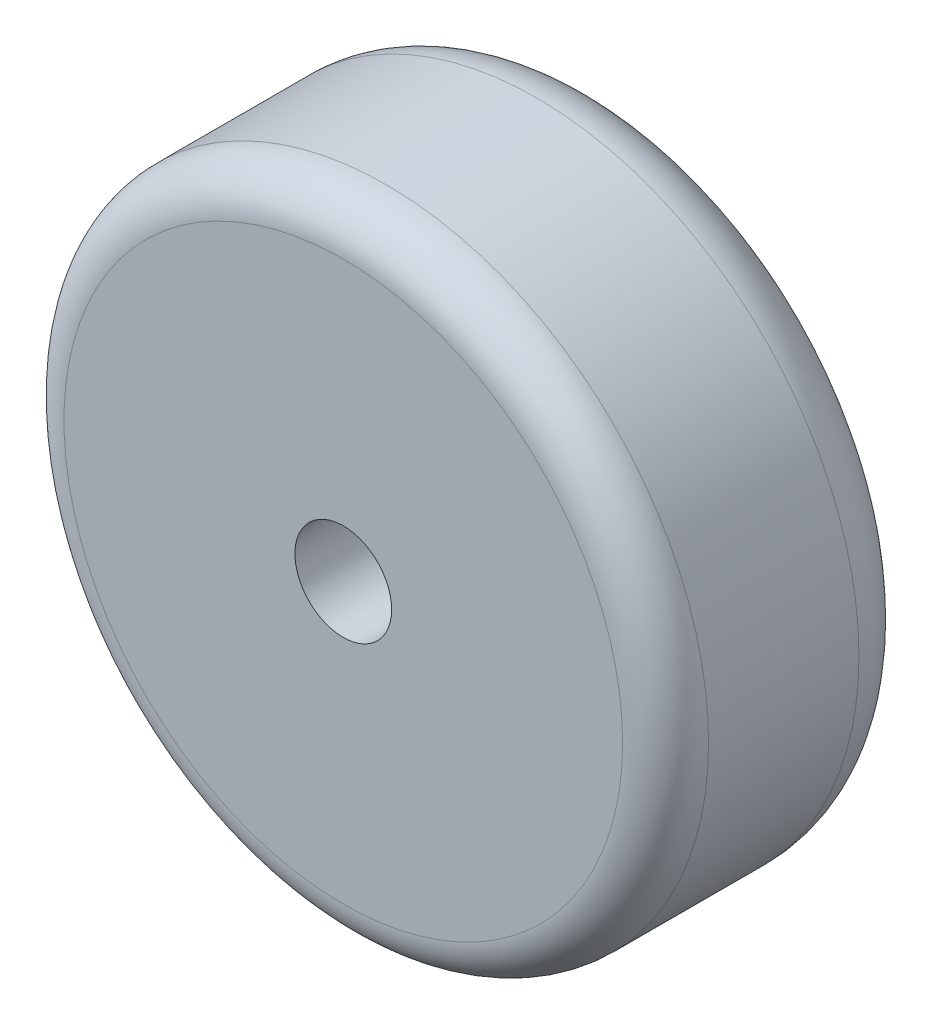
from build123d import *

# Parameters (mm, degrees)
SKETCH_1_R      = 15
SKETCH_1_R_2    = 2.25
EXTRUDE_1_DEPTH = 12
FILLET_1_R      = 2
FILLET_2_R      = 3


with BuildPart() as part:
    # Эскиз1 → Бобышка-Вытянуть1 (new body)
    with BuildSketch(Plane.XY):
        Circle(SKETCH_1_R)
        Circle(SKETCH_1_R_2, mode=Mode.SUBTRACT)
    extrude(amount=EXTRUDE_1_DEPTH)

    # Скругление1
    fillet_1_edges = [part.edges().sort_by_distance(p)[0] for p in [
        (-15, 0, 12),
    ]]
    fillet(fillet_1_edges, radius=FILLET_1_R)

    # Скругление2
    fillet_2_edges = [part.edges().sort_by_distance(p)[0] for p in [
        (-15, 0, 0),
    ]]
    fillet(fillet_2_edges, radius=FILLET_2_R)


solid = part.part
